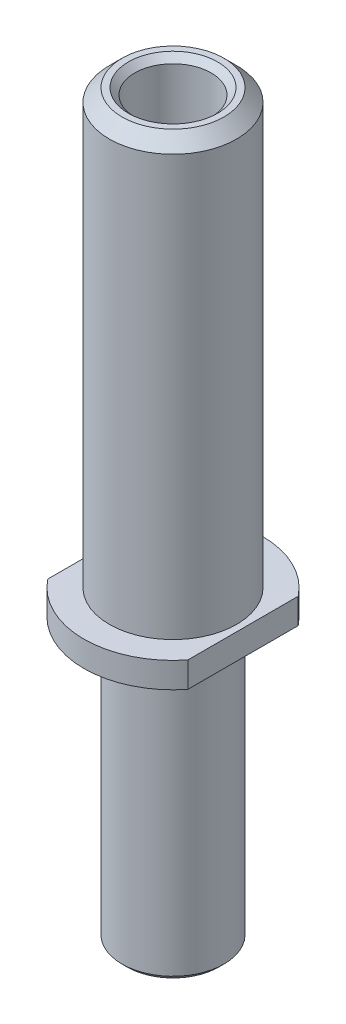
from build123d import *

# Parameters (mm, degrees)
CUT_EXTRUDE1_REACH = 31.419


with BuildPart() as part:
    # Sketch1 → Revolve1 (revolve)
    with BuildSketch(Plane(origin=(0, 0, 0), x_dir=(0, 0, -1), z_dir=(1, 0, 0))):
        Polygon((-1.5, 0.2), (-1.5, 28.75), (-1.75, 29), (-2, 29), (-2.5, 28.5), (-2.5, 12), (-3.5, 12), (-3.5, 11), (-2, 11), (-2, 0.2), (-1.8, 0), (-1.7, 0), align=None)
    revolve(axis=Axis((0, 29, 0), (0, -1, 0)))

    # Sketch2 → Cut-Extrude1 (cut, up to next)
    with BuildSketch(Plane(origin=(0, 0, 0), x_dir=(1, 0, 0), z_dir=(0, 1, 0)), mode=Mode.PRIVATE) as cut_extrude1_sk1:
        with BuildLine():
            Line((-2.75, 2.165063509), (-2.75, -2.165063509))
            ThreePointArc((-2.75, -2.165063509), (-3.5, 0), (-2.75, 2.165063509))
        make_face()
    cut_extrude1_tool1 = extrude(cut_extrude1_sk1.sketch, amount=CUT_EXTRUDE1_REACH, mode=Mode.PRIVATE) & part.part
    # Sketch2 → Cut-Extrude1 (cut, up to next)
    with BuildSketch(Plane(origin=(0, 0, 0), x_dir=(1, 0, 0), z_dir=(0, 1, 0)), mode=Mode.PRIVATE) as cut_extrude1_sk2:
        with BuildLine():
            Line((2.75, 2.165063509), (2.75, -2.165063509))
            ThreePointArc((2.75, -2.165063509), (3.5, 0), (2.75, 2.165063509))
        make_face()
    cut_extrude1_tool2 = extrude(cut_extrude1_sk2.sketch, amount=CUT_EXTRUDE1_REACH, mode=Mode.PRIVATE) & part.part
    add(cut_extrude1_tool1.solids().sort_by_distance((-3.052938, 0, 0))[0], mode=Mode.SUBTRACT)
    add(cut_extrude1_tool2.solids().sort_by_distance((3.052938, 0, 0))[0], mode=Mode.SUBTRACT)


solid = part.part
